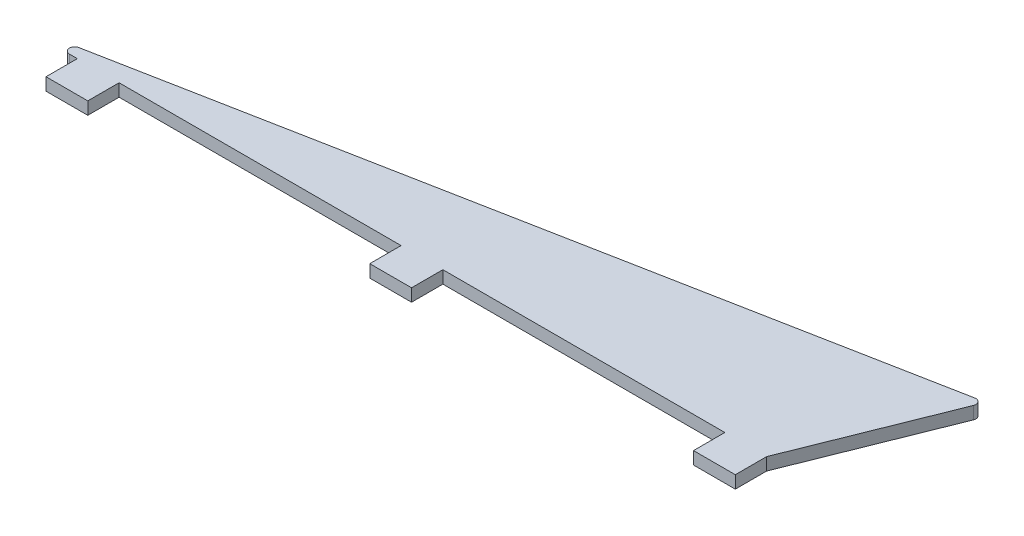
from build123d import *

# Parameters (mm, degrees)
RESSALTO_EXTRUS_O1_DEPTH = 6


with BuildPart() as part:
    # Esboço1 → Ressalto-extrusão1 (new body)
    with BuildSketch(Plane(origin=(0, 0, 0), x_dir=(1, 0, 0), z_dir=(0, 1, 0))):
        with BuildLine():
            Line((-4.233916189, 19.955016117), (355.507733721, 89.136102639))
            ThreePointArc((355.507733721, 89.136102639), (357.907745838, 88.272697698), (358.301043932, 85.75260983))
            Line((358.301043932, 85.75260983), (330, 15))
            Line((330, 15), (330, 0))
            Line((330, 0), (310, 0))
            Line((310, 0), (310, 15))
            Line((310, 15), (175, 15))
            Line((175, 15), (175, 0))
            Line((175, 0), (155, 0))
            Line((155, 0), (155, 15))
            Line((155, 15), (20, 15))
            Line((20, 15), (20, 0))
            Line((20, 0), (0, 0))
            Line((0, 0), (0, 15))
            Line((0, 15), (-3.761797705, 15))
            ThreePointArc((-3.761797705, 15), (-6.250526326, 17.262871653), (-4.233916189, 19.955016117))
        make_face()
    extrude(amount=RESSALTO_EXTRUS_O1_DEPTH)


solid = part.part
